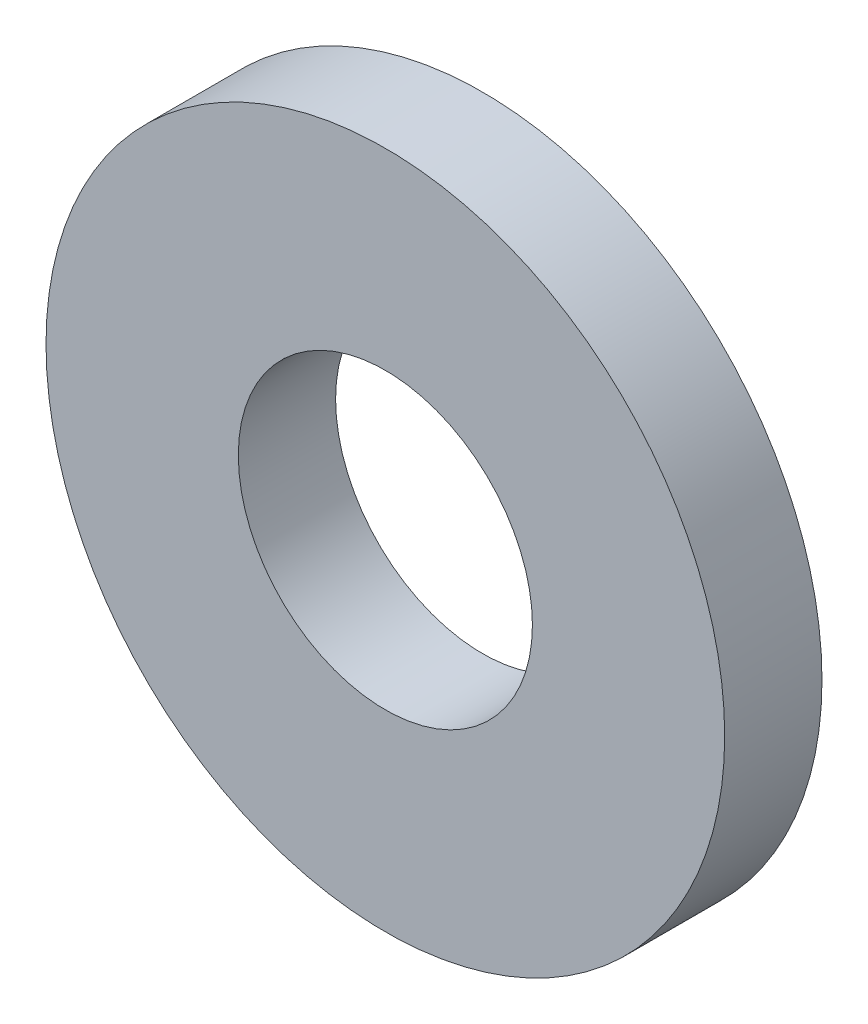
from build123d import *

# Parameters (mm, degrees)
SKETCH1_R           = 3.81
SKETCH1_R_2         = 1.651
BOSS_EXTRUDE1_DEPTH = 1.0922


with BuildPart() as part:
    # Sketch1 → Boss-Extrude1 (new body)
    with BuildSketch(Plane.XY):
        Circle(SKETCH1_R)
        Circle(SKETCH1_R_2, mode=Mode.SUBTRACT)
    extrude(amount=BOSS_EXTRUDE1_DEPTH)


solid = part.part
